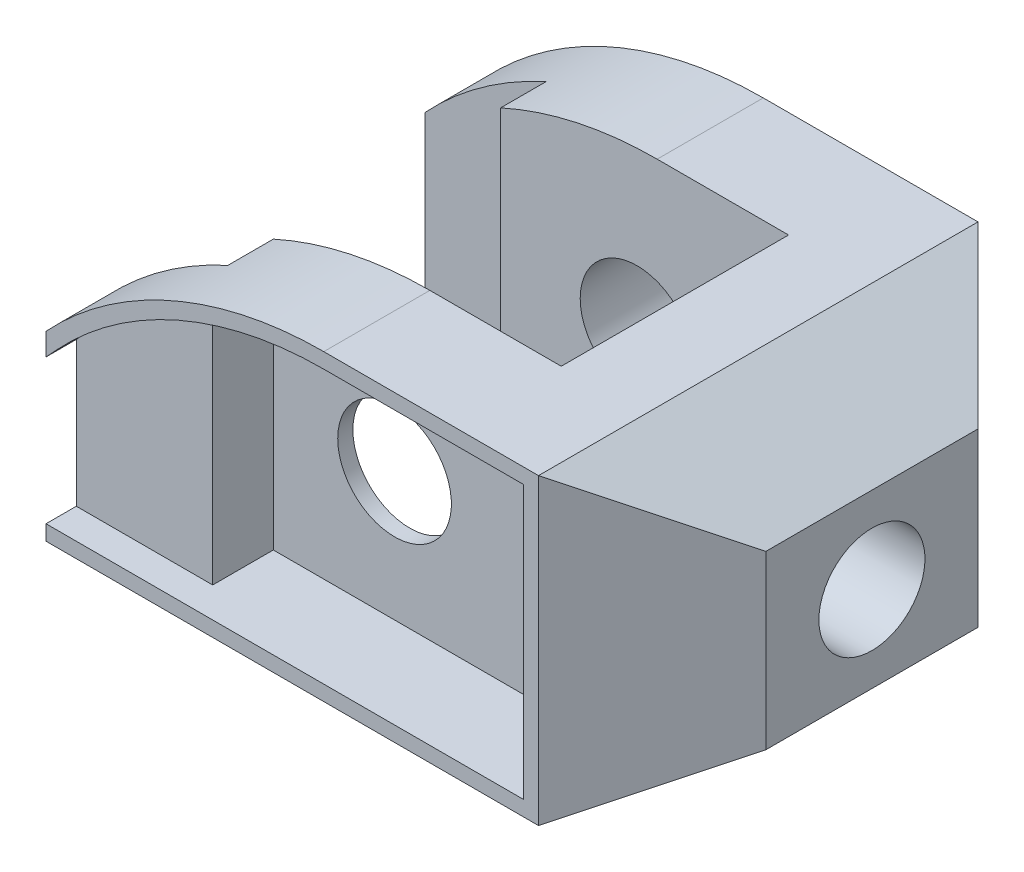
from build123d import *

# Parameters (mm, degrees)
SKETCH1_R               = 7.5
BOSS_EXTRUDE1_DEPTH     = 29
CUT_EXTRUDE1_DEPTH      = 65
CUT_EXTRUDE2_DEPTH      = 95.026591983
CUT_EXTRUDE2_DEPTH_BACK = 38
SKETCH4_R               = 7
CUT_EXTRUDE3_DEPTH      = 40
CUT_EXTRUDE6_START      = -12
SKETCH10_R              = 7.5
CUT_EXTRUDE6_DEPTH      = 12
CUT_EXTRUDE7_START      = -4
CUT_EXTRUDE7_DEPTH      = 4


with BuildPart() as part:
    # Sketch1 → Boss-Extrude1 (new, symmetric)
    with BuildSketch(Plane.XY):
        with BuildLine():
            Line((0, 0), (65, 0))
            Line((65, 0), (80, 8.660254038))
            Line((80, 8.660254038), (80, 31.339745962))
            Line((80, 31.339745962), (65, 40))
            Line((65, 40), (36.66060556, 40))
            ThreePointArc((36.66060556, 40), (16.66060556, 35.82575695), (0, 24))
            Line((0, 24), (0, 0))
        make_face()
        with Locations((34, 19)):
            Circle(SKETCH1_R, mode=Mode.SUBTRACT)
    extrude(amount=BOSS_EXTRUDE1_DEPTH, both=True)

    # Sketch2 → Cut-Extrude1 (cut)
    with BuildSketch(Plane(origin=(0, 0, 0), x_dir=(1, 0, 0), z_dir=(0, 1, 0))):
        Polygon((0, 20.995620851), (16, 20.995620851), (16, 15), (54, 15), (54, -15), (16, -15), (16, -21), (0, -21), align=None)
    extrude(amount=CUT_EXTRUDE1_DEPTH, mode=Mode.SUBTRACT)

    # Sketch4 → Cut-Extrude2 (cut, two sides: drawn at the far end of the back side and taken through both)
    with BuildSketch(Plane(origin=(80, 0, 0), x_dir=(0, 0, -1), z_dir=(1, 0, 0)).offset(-CUT_EXTRUDE2_DEPTH_BACK)):
        with Locations((0, 20)):
            Circle(SKETCH4_R)
    extrude(amount=CUT_EXTRUDE2_DEPTH + CUT_EXTRUDE2_DEPTH_BACK, mode=Mode.SUBTRACT)

    # Sketch6 → Cut-Extrude3 (cut)
    with BuildSketch(Plane(origin=(0, 0, 0), x_dir=(1, 0, 0), z_dir=(0, 1, 0))):
        Polygon((65, 29), (80, 29), (80, 14), align=None)
        Polygon((65, -29), (80, -29), (80, -14), align=None)
    extrude(amount=CUT_EXTRUDE3_DEPTH, mode=Mode.SUBTRACT)

    # Sketch10 → Cut-Extrude6 (cut)
    with BuildSketch(Plane.XY.offset(29).offset(CUT_EXTRUDE6_START)):
        with BuildLine():
            Line((18, 34.224221872), (18, 2))
            Line((18, 2), (63, 2))
            Line((63, 2), (63, 38))
            Line((63, 38), (36.66060556, 38))
            ThreePointArc((36.66060556, 38), (27.141221384, 37.046586751), (18, 34.224221872))
        make_face()
        with Locations((34, 19)):
            Circle(SKETCH10_R, mode=Mode.SUBTRACT)
    extrude(amount=CUT_EXTRUDE6_DEPTH, mode=Mode.SUBTRACT)

    # Sketch10<5> → Cut-Extrude7 (cut)
    with BuildSketch(Plane.XY.offset(29).offset(CUT_EXTRUDE7_START)):
        with BuildLine():
            Line((18, 2), (18, 34.224221872))
            ThreePointArc((18, 34.224221872), (9.117311148, 29.311155325), (1.466424222, 22.64))
            Line((1.466424222, 22.64), (0, 21.058823529))
            Line((0, 21.058823529), (0, 2))
            Line((0, 2), (18, 2))
        make_face()
    extrude(amount=CUT_EXTRUDE7_DEPTH, mode=Mode.SUBTRACT)


solid = part.part
